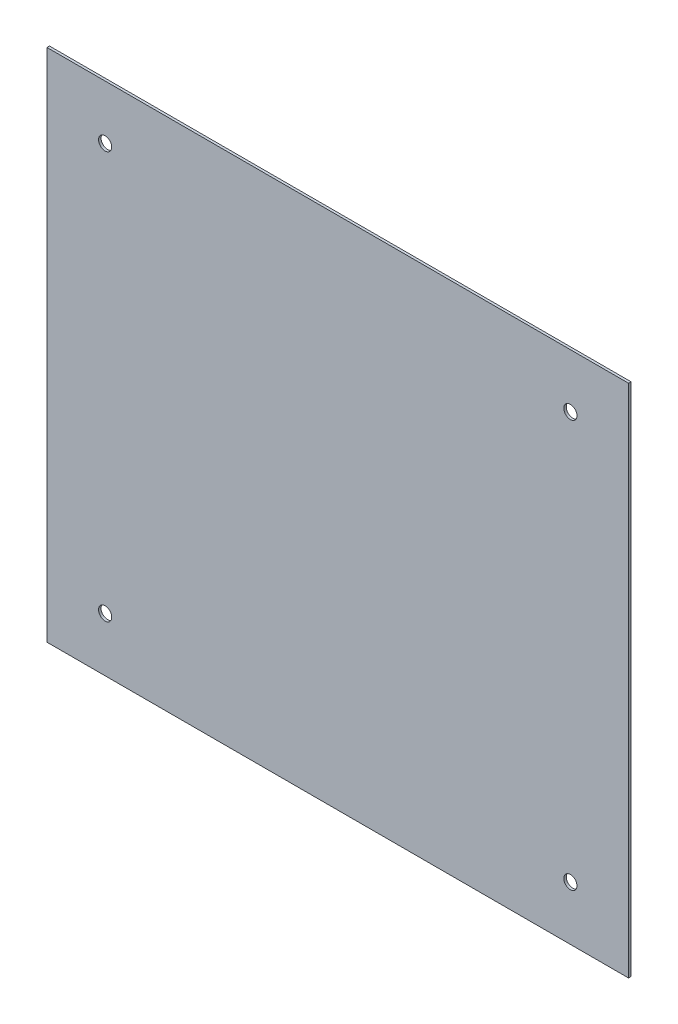
from build123d import *

# Parameters (mm, degrees)
SKETCH1_W               = 350
SKETCH1_H               = 310
BOSS_EXTRUDE1_DEPTH     = 1.5
CUT_EXTRUDE1_DEPTH      = 10
CUT_EXTRUDE1_DEPTH_BACK = 10
SKETCH3_R               = 3.97


with BuildPart() as part:
    # Sketch1 → Boss-Extrude1 (new body)
    with BuildSketch(Plane.XY):
        Rectangle(SKETCH1_W, SKETCH1_H)
    extrude(amount=BOSS_EXTRUDE1_DEPTH)

    # Sketch3 → Cut-Extrude1 (cut, two sides: drawn at the far end of the back side and taken through both)
    with BuildSketch(Plane.XY.offset(1.5).offset(-CUT_EXTRUDE1_DEPTH_BACK)):
        with Locations((-140, 122.5)):
            Circle(SKETCH3_R)
        with Locations((140, 122.5)):
            Circle(SKETCH3_R)
        with Locations((-140, -122.5)):
            Circle(SKETCH3_R)
        with Locations((140, -122.5)):
            Circle(SKETCH3_R)
    extrude(amount=CUT_EXTRUDE1_DEPTH + CUT_EXTRUDE1_DEPTH_BACK, mode=Mode.SUBTRACT)


solid = part.part
